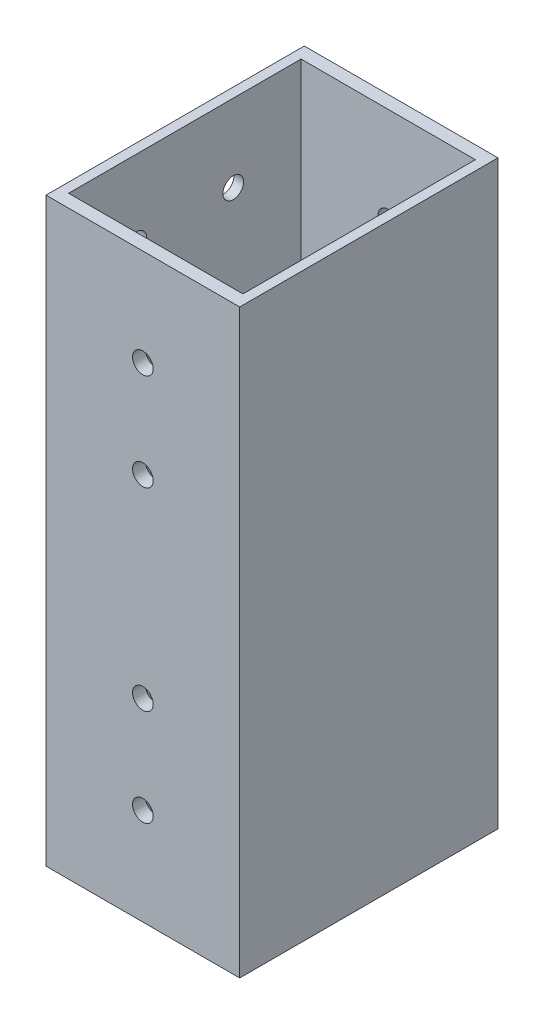
from build123d import *

# Parameters (mm, degrees)
SKETCH_1_W               = 30
SKETCH_1_H               = 40
SKETCH_1_W_2             = 27
SKETCH_1_H_2             = 36
EXTRUDE_1_DEPTH          = 90
CUT_EXTRUDE_1_REACH      = 98.954
SKETCH_2_R               = 1.6
CUT_EXTRUDE_2_DEPTH      = 99.838251704
CUT_EXTRUDE_2_DEPTH_BACK = 99.838251704
SKETCH_3_R               = 1.6


with BuildPart() as part:
    # 草图1 → 凸台-拉伸1 (new body)
    with BuildSketch(Plane(origin=(0, 0, 0), x_dir=(1, 0, 0), z_dir=(0, 1, 0))):
        Rectangle(SKETCH_1_W, SKETCH_1_H)
        Rectangle(SKETCH_1_W_2, SKETCH_1_H_2, mode=Mode.SUBTRACT)
    extrude(amount=EXTRUDE_1_DEPTH)

    # 草图2 → 切除-拉伸1 (cut, up to next)
    with BuildSketch(Plane.ZY.offset(15), mode=Mode.PRIVATE) as cut_extrude_1_sk1:
        with Locations((7.5, 78)):
            Circle(SKETCH_2_R)
    cut_extrude_1_tool1 = extrude(cut_extrude_1_sk1.sketch, amount=-CUT_EXTRUDE_1_REACH, mode=Mode.PRIVATE) & part.part
    # 草图2 → 切除-拉伸1 (cut, up to next)
    with BuildSketch(Plane.ZY.offset(15), mode=Mode.PRIVATE) as cut_extrude_1_sk2:
        with Locations((-7.5, 78)):
            Circle(SKETCH_2_R)
    cut_extrude_1_tool2 = extrude(cut_extrude_1_sk2.sketch, amount=-CUT_EXTRUDE_1_REACH, mode=Mode.PRIVATE) & part.part
    # 草图2 → 切除-拉伸1 (cut, up to next)
    with BuildSketch(Plane.ZY.offset(15), mode=Mode.PRIVATE) as cut_extrude_1_sk3:
        with Locations((-7.5, 62)):
            Circle(SKETCH_2_R)
    cut_extrude_1_tool3 = extrude(cut_extrude_1_sk3.sketch, amount=-CUT_EXTRUDE_1_REACH, mode=Mode.PRIVATE) & part.part
    # 草图2 → 切除-拉伸1 (cut, up to next)
    with BuildSketch(Plane.ZY.offset(15), mode=Mode.PRIVATE) as cut_extrude_1_sk4:
        with Locations((7.5, 62)):
            Circle(SKETCH_2_R)
    cut_extrude_1_tool4 = extrude(cut_extrude_1_sk4.sketch, amount=-CUT_EXTRUDE_1_REACH, mode=Mode.PRIVATE) & part.part
    # 草图2 → 切除-拉伸1 (cut, up to next)
    with BuildSketch(Plane.ZY.offset(15), mode=Mode.PRIVATE) as cut_extrude_1_sk5:
        with Locations((7.5, 28)):
            Circle(SKETCH_2_R)
    cut_extrude_1_tool5 = extrude(cut_extrude_1_sk5.sketch, amount=-CUT_EXTRUDE_1_REACH, mode=Mode.PRIVATE) & part.part
    # 草图2 → 切除-拉伸1 (cut, up to next)
    with BuildSketch(Plane.ZY.offset(15), mode=Mode.PRIVATE) as cut_extrude_1_sk6:
        with Locations((7.5, 12)):
            Circle(SKETCH_2_R)
    cut_extrude_1_tool6 = extrude(cut_extrude_1_sk6.sketch, amount=-CUT_EXTRUDE_1_REACH, mode=Mode.PRIVATE) & part.part
    # 草图2 → 切除-拉伸1 (cut, up to next)
    with BuildSketch(Plane.ZY.offset(15), mode=Mode.PRIVATE) as cut_extrude_1_sk7:
        with Locations((-7.5, 28)):
            Circle(SKETCH_2_R)
    cut_extrude_1_tool7 = extrude(cut_extrude_1_sk7.sketch, amount=-CUT_EXTRUDE_1_REACH, mode=Mode.PRIVATE) & part.part
    # 草图2 → 切除-拉伸1 (cut, up to next)
    with BuildSketch(Plane.ZY.offset(15), mode=Mode.PRIVATE) as cut_extrude_1_sk8:
        with Locations((-7.5, 12)):
            Circle(SKETCH_2_R)
    cut_extrude_1_tool8 = extrude(cut_extrude_1_sk8.sketch, amount=-CUT_EXTRUDE_1_REACH, mode=Mode.PRIVATE) & part.part
    add(cut_extrude_1_tool1.solids().sort_by_distance((-15, 78, 7.5))[0], mode=Mode.SUBTRACT)
    add(cut_extrude_1_tool2.solids().sort_by_distance((-15, 78, -7.5))[0], mode=Mode.SUBTRACT)
    add(cut_extrude_1_tool3.solids().sort_by_distance((-15, 62, -7.5))[0], mode=Mode.SUBTRACT)
    add(cut_extrude_1_tool4.solids().sort_by_distance((-15, 62, 7.5))[0], mode=Mode.SUBTRACT)
    add(cut_extrude_1_tool5.solids().sort_by_distance((-15, 28, 7.5))[0], mode=Mode.SUBTRACT)
    add(cut_extrude_1_tool6.solids().sort_by_distance((-15, 12, 7.5))[0], mode=Mode.SUBTRACT)
    add(cut_extrude_1_tool7.solids().sort_by_distance((-15, 28, -7.5))[0], mode=Mode.SUBTRACT)
    add(cut_extrude_1_tool8.solids().sort_by_distance((-15, 12, -7.5))[0], mode=Mode.SUBTRACT)

    # 草图3 → 切除-拉伸2 (cut, two sides: drawn at the far end of the back side and taken through both)
    with BuildSketch(Plane(origin=(0, 0, 18), x_dir=(-1, 0, 0), z_dir=(0, 0, -1)).offset(-CUT_EXTRUDE_2_DEPTH_BACK)):
        with Locations((0, 30)):
            Circle(SKETCH_3_R)
        with Locations((0, 15)):
            Circle(SKETCH_3_R)
        with Locations((0, 75)):
            Circle(SKETCH_3_R)
        with Locations((0, 60)):
            Circle(SKETCH_3_R)
    extrude(amount=CUT_EXTRUDE_2_DEPTH + CUT_EXTRUDE_2_DEPTH_BACK, mode=Mode.SUBTRACT)


solid = part.part
